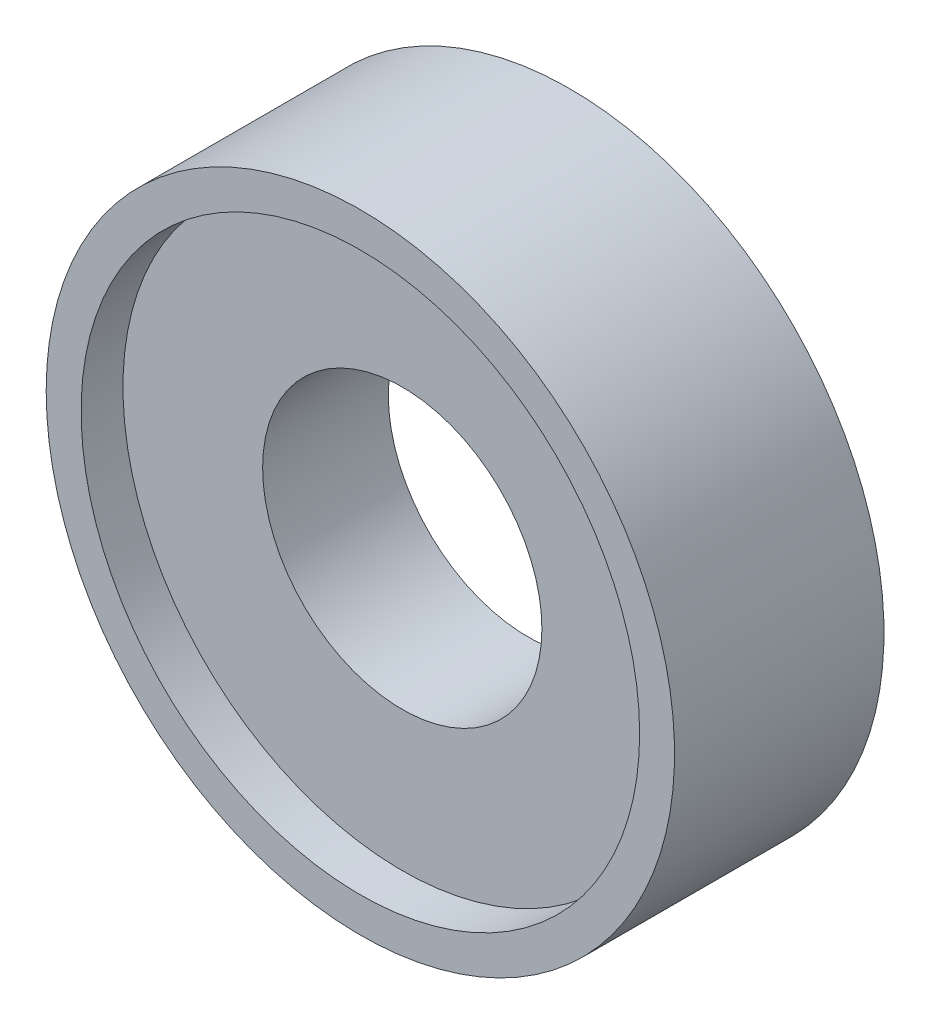
from build123d import *

# Parameters (mm, degrees)
SKETCH1_R           = 57.15
BOSS_EXTRUDE1_DEPTH = 38.1
SKETCH2_R           = 25.4
CUT_EXTRUDE1_DEPTH  = 38.1
SKETCH3_R           = 50.8
CUT_EXTRUDE2_DEPTH  = 7.62
CUT_EXTRUDE3_START  = -7.62
SKETCH5_R           = 50.8
CUT_EXTRUDE3_DEPTH  = 7.62


with BuildPart() as part:
    # Sketch1 → Boss-Extrude1 (new body)
    with BuildSketch(Plane.XY):
        with Locations(Location((0, 0, 0), (0, 0, 180))):
            Circle(SKETCH1_R)
    extrude(amount=BOSS_EXTRUDE1_DEPTH)

    # Sketch2 → Cut-Extrude1 (cut)
    with BuildSketch(Plane.XY.offset(38.1)):
        Circle(SKETCH2_R)
    extrude(amount=-CUT_EXTRUDE1_DEPTH, mode=Mode.SUBTRACT)

    # Sketch3 → Cut-Extrude2 (cut)
    with BuildSketch(Plane.XY.offset(38.1)):
        Circle(SKETCH3_R)
    extrude(amount=-CUT_EXTRUDE2_DEPTH, mode=Mode.SUBTRACT)

    # Sketch5 → Cut-Extrude3 (cut)
    with BuildSketch(Plane(origin=(0, 0, 0), x_dir=(-1, 0, 0), z_dir=(0, 0, -1)).offset(CUT_EXTRUDE3_START)):
        with Locations(Location((0, 0, 0), (0, 0, 180))):
            Circle(SKETCH5_R)
    extrude(amount=CUT_EXTRUDE3_DEPTH, mode=Mode.SUBTRACT)


solid = part.part
